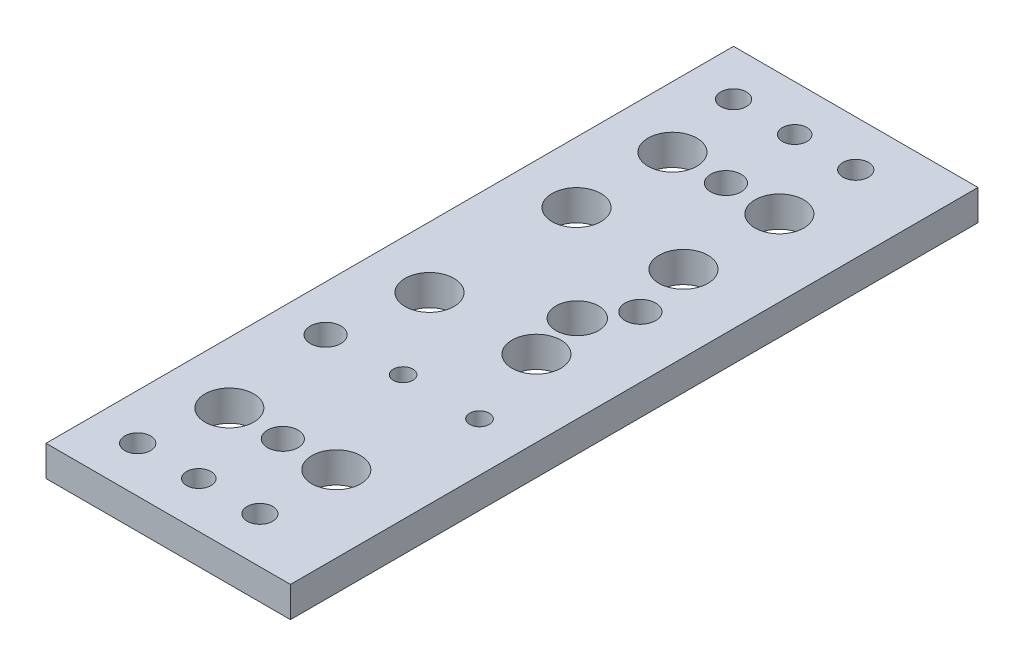
from build123d import *

# Parameters (mm, degrees)
SKETCH2_W                  = 80
SKETCH2_H                  = 225
BOSS_EXTRUDE1_DEPTH        = 10
CUT_EXTRUDE1_REACH         = 121.818
SKETCH3_R                  = 8
M8_CLEARANCE_HOLE1_D       = 8.4
F_8_0MM_DOWEL_HOLE1_D      = 8
F_10_0_10_DIAMETER_HOLE1_D = 10
M6_CLEARANCE_HOLE1_D       = 6.4
CUT_EXTRUDE2_REACH         = 121.818
SKETCH16_R                 = 7


with BuildPart() as part:
    # Sketch2 → Boss-Extrude1 (new body)
    with BuildSketch(Plane(origin=(0, 0, 0), x_dir=(1, 0, 0), z_dir=(0, 1, 0))):
        Rectangle(SKETCH2_W, SKETCH2_H)
    extrude(amount=-BOSS_EXTRUDE1_DEPTH)

    # Sketch3 → Cut-Extrude1 (cut, up to next)
    with BuildSketch(Plane(origin=(0, 0, 0), x_dir=(1, 0, 0), z_dir=(0, 1, 0)), mode=Mode.PRIVATE) as cut_extrude1_sk1:
        with Locations((15, -7)):
            Circle(SKETCH3_R)
    cut_extrude1_tool1 = extrude(cut_extrude1_sk1.sketch, amount=-CUT_EXTRUDE1_REACH, mode=Mode.PRIVATE) & part.part
    # Sketch3 → Cut-Extrude1 (cut, up to next)
    with BuildSketch(Plane(origin=(0, 0, 0), x_dir=(1, 0, 0), z_dir=(0, 1, 0)), mode=Mode.PRIVATE) as cut_extrude1_sk2:
        with Locations((15, 41.11)):
            Circle(SKETCH3_R)
    cut_extrude1_tool2 = extrude(cut_extrude1_sk2.sketch, amount=-CUT_EXTRUDE1_REACH, mode=Mode.PRIVATE) & part.part
    # Sketch3 → Cut-Extrude1 (cut, up to next)
    with BuildSketch(Plane(origin=(0, 0, 0), x_dir=(1, 0, 0), z_dir=(0, 1, 0)), mode=Mode.PRIVATE) as cut_extrude1_sk3:
        with Locations((15, -72.5)):
            Circle(SKETCH3_R)
    cut_extrude1_tool3 = extrude(cut_extrude1_sk3.sketch, amount=-CUT_EXTRUDE1_REACH, mode=Mode.PRIVATE) & part.part
    # Sketch3 → Cut-Extrude1 (cut, up to next)
    with BuildSketch(Plane(origin=(0, 0, 0), x_dir=(1, 0, 0), z_dir=(0, 1, 0)), mode=Mode.PRIVATE) as cut_extrude1_sk4:
        with Locations((-20, -72.5)):
            Circle(SKETCH3_R)
    cut_extrude1_tool4 = extrude(cut_extrude1_sk4.sketch, amount=-CUT_EXTRUDE1_REACH, mode=Mode.PRIVATE) & part.part
    # Sketch3 → Cut-Extrude1 (cut, up to next)
    with BuildSketch(Plane(origin=(0, 0, 0), x_dir=(1, 0, 0), z_dir=(0, 1, 0)), mode=Mode.PRIVATE) as cut_extrude1_sk5:
        with Locations((-20, -7)):
            Circle(SKETCH3_R)
    cut_extrude1_tool5 = extrude(cut_extrude1_sk5.sketch, amount=-CUT_EXTRUDE1_REACH, mode=Mode.PRIVATE) & part.part
    # Sketch3 → Cut-Extrude1 (cut, up to next)
    with BuildSketch(Plane(origin=(0, 0, 0), x_dir=(1, 0, 0), z_dir=(0, 1, 0)), mode=Mode.PRIVATE) as cut_extrude1_sk6:
        with Locations((-20, 41.11)):
            Circle(SKETCH3_R)
    cut_extrude1_tool6 = extrude(cut_extrude1_sk6.sketch, amount=-CUT_EXTRUDE1_REACH, mode=Mode.PRIVATE) & part.part
    # Sketch3 → Cut-Extrude1 (cut, up to next)
    with BuildSketch(Plane(origin=(0, 0, 0), x_dir=(1, 0, 0), z_dir=(0, 1, 0)), mode=Mode.PRIVATE) as cut_extrude1_sk7:
        with Locations((-20, 72.5)):
            Circle(SKETCH3_R)
    cut_extrude1_tool7 = extrude(cut_extrude1_sk7.sketch, amount=-CUT_EXTRUDE1_REACH, mode=Mode.PRIVATE) & part.part
    # Sketch3 → Cut-Extrude1 (cut, up to next)
    with BuildSketch(Plane(origin=(0, 0, 0), x_dir=(1, 0, 0), z_dir=(0, 1, 0)), mode=Mode.PRIVATE) as cut_extrude1_sk8:
        with Locations((15, 72.5)):
            Circle(SKETCH3_R)
    cut_extrude1_tool8 = extrude(cut_extrude1_sk8.sketch, amount=-CUT_EXTRUDE1_REACH, mode=Mode.PRIVATE) & part.part
    add(cut_extrude1_tool1.solids().sort_by_distance((15, 0, 7))[0], mode=Mode.SUBTRACT)
    add(cut_extrude1_tool2.solids().sort_by_distance((15, 0, -41.11))[0], mode=Mode.SUBTRACT)
    add(cut_extrude1_tool3.solids().sort_by_distance((15, 0, 72.5))[0], mode=Mode.SUBTRACT)
    add(cut_extrude1_tool4.solids().sort_by_distance((-20, 0, 72.5))[0], mode=Mode.SUBTRACT)
    add(cut_extrude1_tool5.solids().sort_by_distance((-20, 0, 7))[0], mode=Mode.SUBTRACT)
    add(cut_extrude1_tool6.solids().sort_by_distance((-20, 0, -41.11))[0], mode=Mode.SUBTRACT)
    add(cut_extrude1_tool7.solids().sort_by_distance((-20, 0, -72.5))[0], mode=Mode.SUBTRACT)
    add(cut_extrude1_tool8.solids().sort_by_distance((15, 0, -72.5))[0], mode=Mode.SUBTRACT)

    # M8 Clearance Hole1 (through all)
    with Locations(Plane(origin=(0, 0, 0), x_dir=(1, 0, 0), z_dir=(0, 1, 0))):
        with Locations((-25, -97.5), (15, -97.5), (15, 97.5), (-25, 97.5)):
            Hole(M8_CLEARANCE_HOLE1_D / 2)

    # Ø8.0mm Dowel Hole1 (through all)
    with Locations(Plane(origin=(0, 0, 0), x_dir=(1, 0, 0), z_dir=(0, 1, 0))):
        with Locations((-5, 97.5), (-5, -97.5)):
            Hole(F_8_0MM_DOWEL_HOLE1_D / 2)

    # Ø10.0 (10) Diameter Hole1 (through all)
    with Locations(Plane(origin=(0, 0, 0), x_dir=(1, 0, 0), z_dir=(0, 1, 0))):
        with Locations((-2.5, -72.5), (-2.5, 72.5), (20, 22), (-25, -36)):
            Hole(F_10_0_10_DIAMETER_HOLE1_D / 2)

    # M6 Clearance Hole1 (through all)
    with Locations(Plane(origin=(0, 0, 0), x_dir=(1, 0, 0), z_dir=(0, 1, 0))):
        with Locations((24, -34.64), (-1, -34.64)):
            Hole(M6_CLEARANCE_HOLE1_D / 2)

    # Sketch16 → Cut-Extrude2 (cut, up to next)
    with BuildSketch(Plane(origin=(0, 0, 0), x_dir=(1, 0, 0), z_dir=(0, 1, 0)), mode=Mode.PRIVATE) as cut_extrude2_sk1:
        with Locations((11.5, 9.86)):
            Circle(SKETCH16_R)
    cut_extrude2_tool1 = extrude(cut_extrude2_sk1.sketch, amount=-CUT_EXTRUDE2_REACH, mode=Mode.PRIVATE) & part.part
    add(cut_extrude2_tool1.solids().sort_by_distance((11.5, 0, -9.86))[0], mode=Mode.SUBTRACT)


solid = part.part
